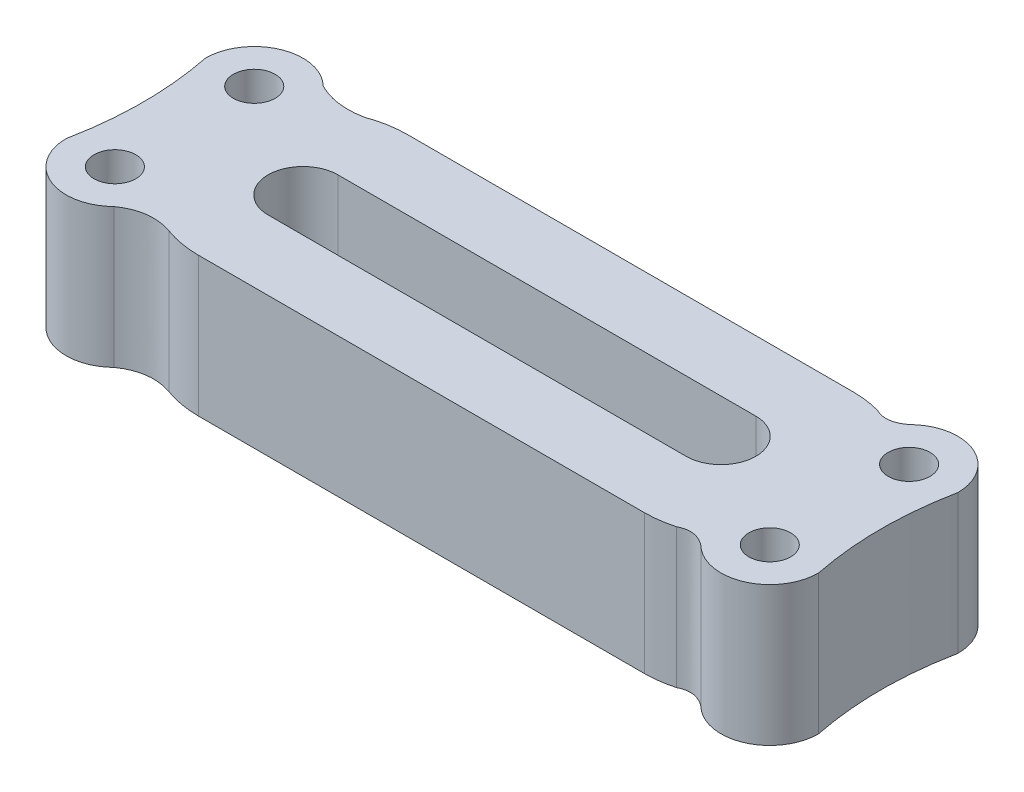
from build123d import *

# Parameters (mm, degrees)
SZKIC1_R                    = 1.5
DODANIE_WYCI_GNI_CIE1_DEPTH = 10


with BuildPart() as part:
    # Szkic1 → Dodanie-wyciągnięcie1 (new body)
    with BuildSketch(Plane(origin=(0, 0, 0), x_dir=(1, 0, 0), z_dir=(0, 1, 0))):
        with BuildLine():
            Line((-15, -5), (17, -5))
            ThreePointArc((17, -5), (18.0250496, -4.929621344), (19.030861437, -4.719806218))
            add(Edge.make_bspline(
                [(21.050510257, -5), (20.034983278, -4.211064237), (19.030861437, -4.719806218)],
                knots=[0, 0, 0, 1, 1, 1], degree=2))
            ThreePointArc((21.050510257, -5), (24.855873501, -5.726702194), (27, -2.5))
            add(Edge.make_bspline(
                [(27, -2.5), (26, 2.5), (27, 7.5)],
                knots=[0, 0, 0, 1, 1, 1], degree=2))
            ThreePointArc((27, 7.5), (24.855873501, 10.726702194), (21.050510257, 10))
            add(Edge.make_bspline(
                [(21.050510257, 10), (20.034983278, 9.211064237), (19.030861437, 9.719806218)],
                knots=[0, 0, 0, 1, 1, 1], degree=2))
            ThreePointArc((19.030861437, 9.719806218), (18.0250496, 9.929621344), (17, 10))
            Line((17, 10), (-15, 10))
            ThreePointArc((-15, 10), (-16.314029759, 9.883991183), (-17.587409108, 9.539553545))
            add(Edge.make_bspline(
                [(-21.050510257, 10), (-19.428457916, 9.156413681), (-17.587409108, 9.539553545)],
                knots=[0, 0, 0, 1, 1, 1], degree=2))
            ThreePointArc((-21.050510257, 10), (-24.855873501, 10.726702194), (-27, 7.5))
            add(Edge.make_bspline(
                [(-27, 7.5), (-26, 2.5), (-27, -2.5)],
                knots=[0, 0, 0, 1, 1, 1], degree=2))
            ThreePointArc((-27, -2.5), (-24.855873501, -5.726702194), (-21.050510257, -5))
            add(Edge.make_bspline(
                [(-21.050510257, -5), (-19.486480964, -3.903838013), (-17.587409108, -4.539553545)],
                knots=[0, 0, 0, 1, 1, 1], degree=2))
            ThreePointArc((-17.587409108, -4.539553545), (-16.314029759, -4.883991183), (-15, -5))
        make_face()
        with Locations(Location((-23.5, -2.5, 0), (0, 0, 270))):
            Circle(SZKIC1_R, mode=Mode.SUBTRACT)
        with Locations(Location((-23.5, 7.5, 0), (0, 0, 270))):
            Circle(SZKIC1_R, mode=Mode.SUBTRACT)
        with Locations(Location((23.5, 7.5, 0), (0, 0, 270))):
            Circle(SZKIC1_R, mode=Mode.SUBTRACT)
        with Locations(Location((23.5, -2.5, 0), (0, 0, 270))):
            Circle(SZKIC1_R, mode=Mode.SUBTRACT)
        with BuildLine():
            Line((-15, 0), (15, 0))
            ThreePointArc((15, 0), (17.5, 2.5), (15, 5))
            Line((15, 5), (-15, 5))
            ThreePointArc((-15, 5), (-17.5, 2.5), (-15, 0))
        make_face(mode=Mode.SUBTRACT)
    extrude(amount=DODANIE_WYCI_GNI_CIE1_DEPTH)


solid = part.part
